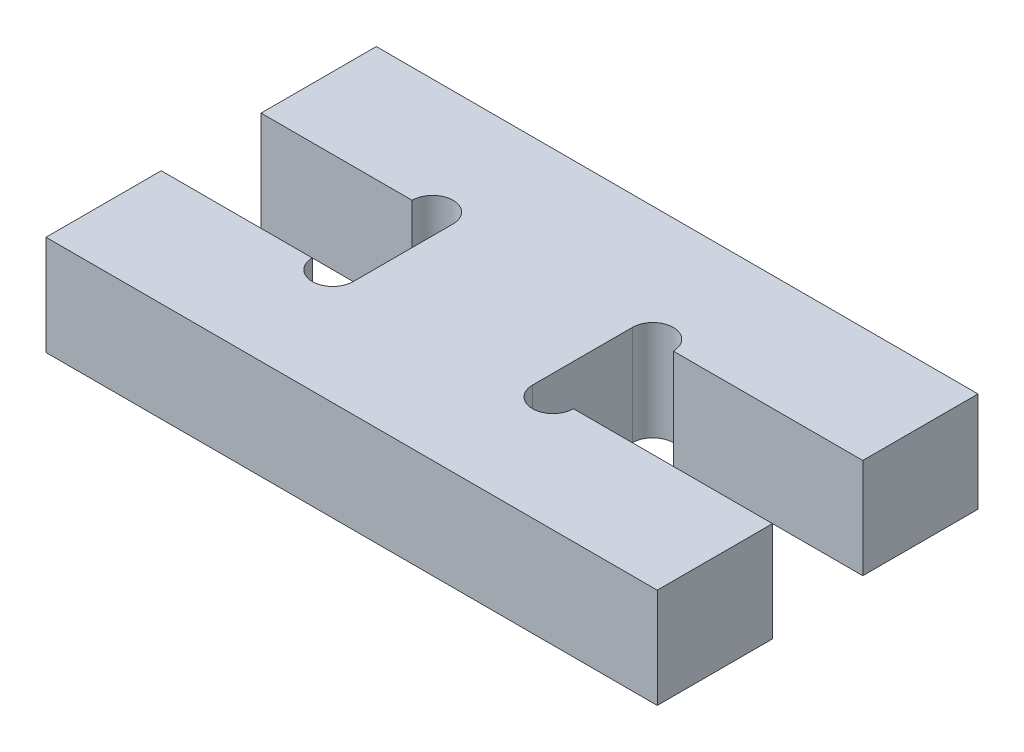
from build123d import *

# Parameters (mm, degrees)
BOSS_EXTRUDE1_DEPTH = 7.8


with BuildPart() as part:
    # Sketch1 → Boss-Extrude1 (new body)
    with BuildSketch(Plane(origin=(0, 0, 0), x_dir=(1, 0, 0), z_dir=(0, 1, 0))):
        with BuildLine():
            Line((0, 9), (0, 0))
            Line((0, 0), (47.747368421, 0))
            Line((47.747368421, 0), (47.747368421, 9))
            Line((47.747368421, 9), (32.2, 9))
            ThreePointArc((32.2, 9), (30.6, 7.4), (29, 9))
            Line((29, 9), (29, 16.8))
            ThreePointArc((29, 16.8), (30.6, 18.4), (32.2, 16.8))
            Line((32.2, 16.8), (47, 16.8))
            Line((47, 16.8), (47, 25.8))
            Line((47, 25.8), (0, 25.8))
            Line((0, 25.8), (0, 16.8))
            Line((0, 16.8), (11.8, 16.8))
            ThreePointArc((11.8, 16.8), (13.4, 18.4), (15, 16.8))
            Line((15, 16.8), (15, 9))
            ThreePointArc((15, 9), (13.4, 7.4), (11.8, 9))
            Line((11.8, 9), (0, 9))
        make_face()
    extrude(amount=BOSS_EXTRUDE1_DEPTH)


solid = part.part
